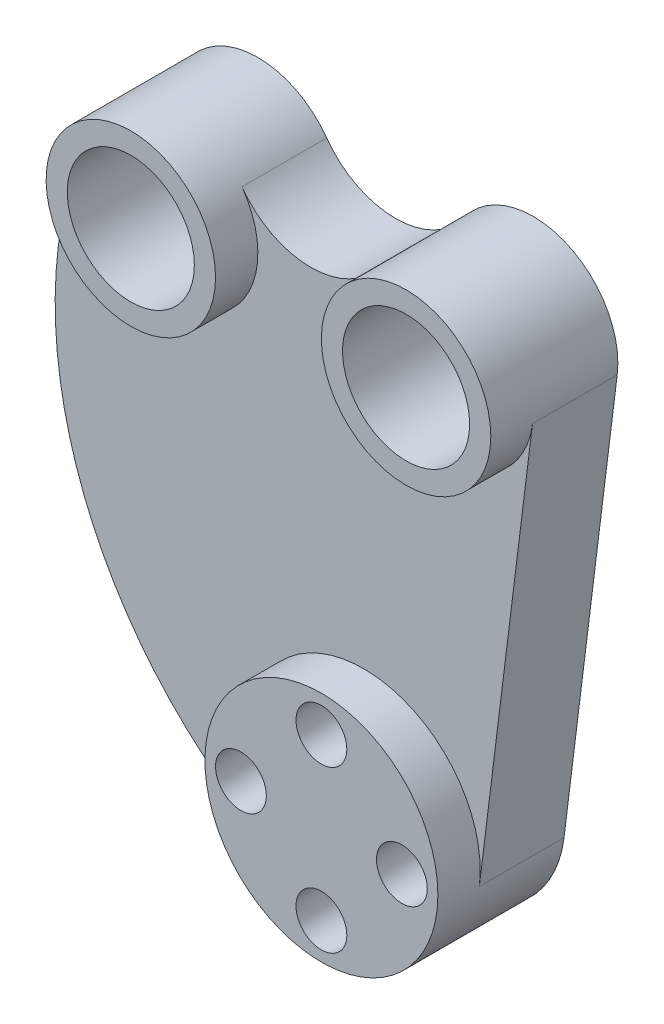
from build123d import *

# Parameters (mm, degrees)
BOSS_EXTRUDE1_DEPTH = 20
SKETCH1_3_R         = 20
SKETCH1_3_R_2       = 15
SKETCH1_3_R_3       = 27.5
SKETCH1_3_R_4       = 6
BOSS_EXTRUDE2_DEPTH = 30


with BuildPart() as part:
    # Sketch1 → Boss-Extrude1 (new body)
    with BuildSketch(Plane.XY):
        with BuildLine():
            Line((72.289579528, -103.395415906), (84.84696693, -2.469393386))
            ThreePointArc((84.84696693, -2.469393386), (57.710349886, -18.624204714), (48.75, 11.659223816))
            ThreePointArc((48.75, 11.659223816), (32.5, 3.318447633), (16.25, 11.659223816))
            ThreePointArc((16.25, 11.659223816), (19.039432765, 6.123724357), (20, 0))
            ThreePointArc((20, 0), (-4.490678851, -19.489325372), (-17.983380346, 8.752030126))
            ThreePointArc((-17.983380346, 8.752030126), (-20.994881076, -70.178879235), (35.195495857, -125.692833602))
            ThreePointArc((35.195495857, -125.692833602), (29.401504302, -77.351888998), (72.5, -100))
            ThreePointArc((72.5, -100), (72.447344471, -101.700964869), (72.289579528, -103.395415906))
        make_face()
    extrude(amount=BOSS_EXTRUDE1_DEPTH)

    # Sketch1<3> → Boss-Extrude2 (add)
    # profile 1 of 3: a face of its own
    with BuildSketch(Plane.XY):
        with Locations((65, 0)):
            Circle(SKETCH1_3_R)
        with Locations((65, 0)):
            Circle(SKETCH1_3_R_2, mode=Mode.SUBTRACT)
    # profile 2 of 3: a face of its own
    with BuildSketch(Plane.XY):
        with Locations((45, -100)):
            Circle(SKETCH1_3_R_3)
        with Locations((26, -100)):
            Circle(SKETCH1_3_R_4, mode=Mode.SUBTRACT)
        with Locations((45, -119)):
            Circle(SKETCH1_3_R_4, mode=Mode.SUBTRACT)
        with Locations((64, -100)):
            Circle(SKETCH1_3_R_4, mode=Mode.SUBTRACT)
        with Locations((45, -81)):
            Circle(SKETCH1_3_R_4, mode=Mode.SUBTRACT)
    # profile 3 of 3: a face of its own
    with BuildSketch(Plane.XY):
        Circle(SKETCH1_3_R)
        Circle(SKETCH1_3_R_2, mode=Mode.SUBTRACT)
    extrude(amount=BOSS_EXTRUDE2_DEPTH)


solid = part.part
